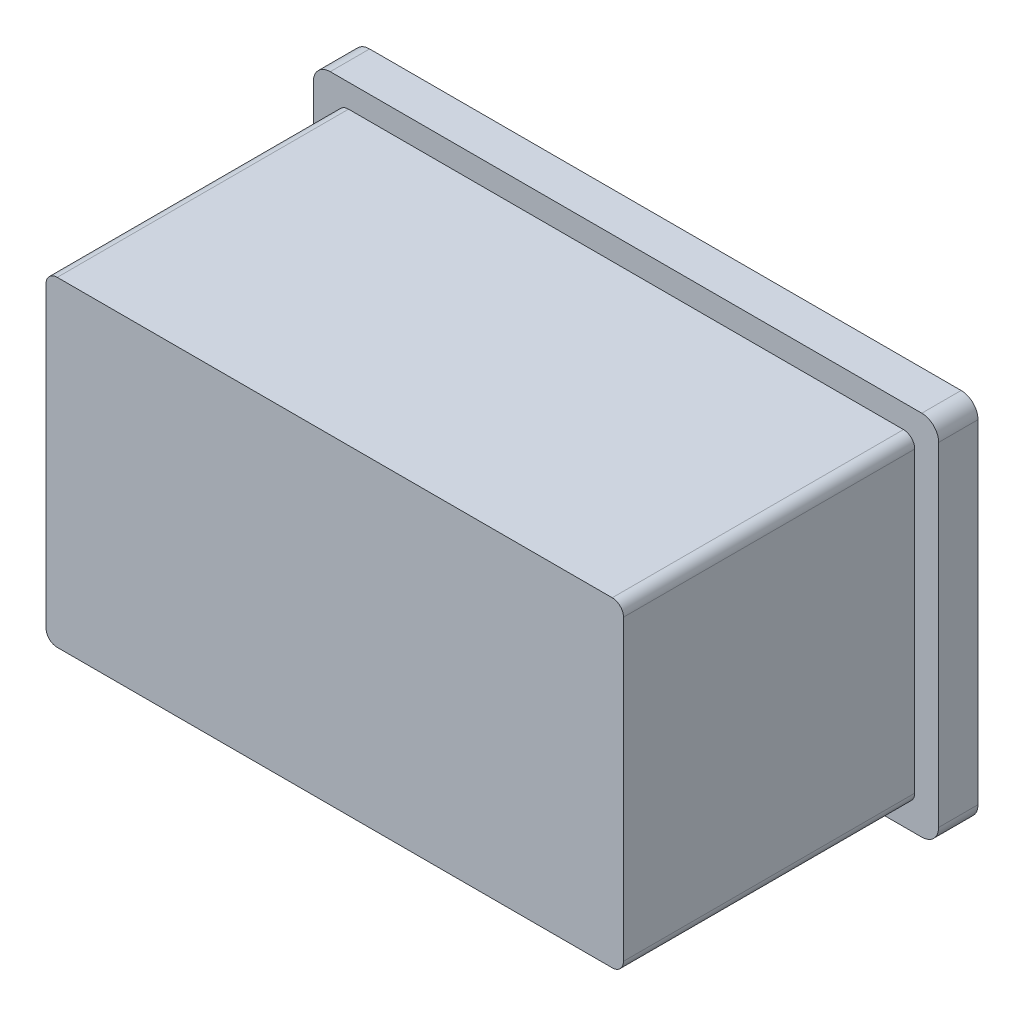
from build123d import *

# Parameters (mm, degrees)
V09_H_BODY102P7X57_FROM_NEW_MANUAL_START = 7
V09_H_BODY102P7X57_FROM_NEW_MANUAL_DEPTH = 51.8
V09_H_FLANGE111P2X65P3_DEPTH7_DEPTH      = 7


with BuildPart() as part:
    # 草图5 → V09_H_body102p7x57_from_new_manual (new body)
    with BuildSketch(Plane.XY.offset(V09_H_BODY102P7X57_FROM_NEW_MANUAL_START)):
        with BuildLine():
            Line((34.15, 8.15), (132.85, 8.15))
            ThreePointArc((132.85, 8.15), (134.264213562, 8.735786438), (134.85, 10.15))
            Line((134.85, 10.15), (134.85, 63.15))
            ThreePointArc((134.85, 63.15), (134.264213562, 64.564213562), (132.85, 65.15))
            Line((132.85, 65.15), (34.15, 65.15))
            ThreePointArc((34.15, 65.15), (32.735786438, 64.564213562), (32.15, 63.15))
            Line((32.15, 63.15), (32.15, 10.15))
            ThreePointArc((32.15, 10.15), (32.735786438, 8.735786438), (34.15, 8.15))
        make_face()
    extrude(amount=V09_H_BODY102P7X57_FROM_NEW_MANUAL_DEPTH)

    # 草图6 → V09_H_flange111p2x65p3_depth7 (add)
    with BuildSketch(Plane.XY):
        with BuildLine():
            Line((30.9, 4), (136.1, 4))
            ThreePointArc((136.1, 4), (138.221320344, 4.878679656), (139.1, 7))
            Line((139.1, 7), (139.1, 66.3))
            ThreePointArc((139.1, 66.3), (138.221320344, 68.421320344), (136.1, 69.3))
            Line((136.1, 69.3), (30.9, 69.3))
            ThreePointArc((30.9, 69.3), (28.778679656, 68.421320344), (27.9, 66.3))
            Line((27.9, 66.3), (27.9, 7))
            ThreePointArc((27.9, 7), (28.778679656, 4.878679656), (30.9, 4))
        make_face()
    extrude(amount=V09_H_FLANGE111P2X65P3_DEPTH7_DEPTH)


solid = part.part
